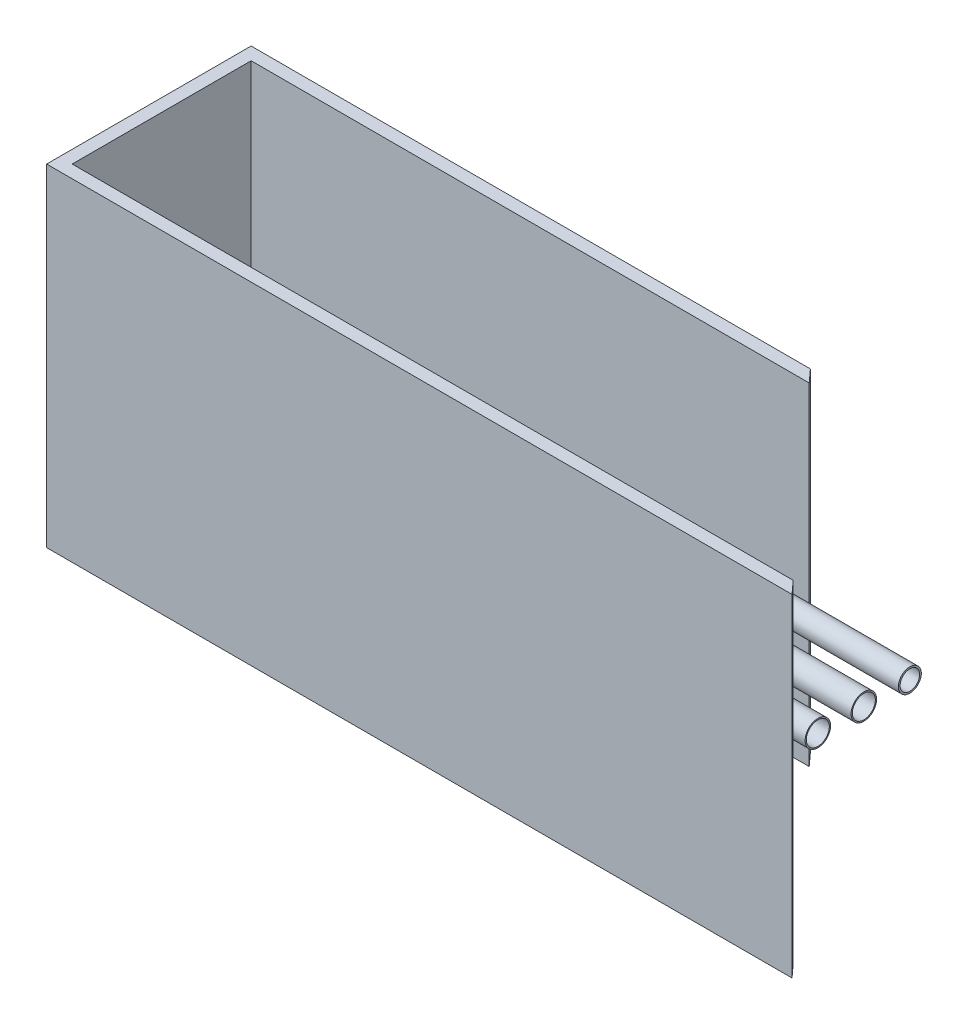
from build123d import *

# Parameters (mm, degrees)
SALIENTE_EXTRUIR1_DEPTH      = 100
SALIENTE_EXTRUIR1_DEPTH_BACK = 1200
CROQUIS1_W                   = 3350
CROQUIS1_H                   = 800
CROQUIS1_W_2                 = 3250
CROQUIS1_H_2                 = 700
CORTAR_EXTRUIR1_DEPTH        = 1448
CROQUIS3_R                   = 44.927583668
CROQUIS3_R_2                 = 38.1
CROQUIS3_R_3                 = 49.927583668


with BuildPart() as part:
    # Croquis1 → Saliente-Extruir1 (new, two sides: drawn at the far end of the back side and taken through both)
    with BuildSketch(Plane(origin=(0, 0, 0), x_dir=(1, 0, 0), z_dir=(0, 1, 0)).offset(-SALIENTE_EXTRUIR1_DEPTH_BACK)):
        Rectangle(CROQUIS1_W, CROQUIS1_H)
        Rectangle(CROQUIS1_W_2, CROQUIS1_H_2, mode=Mode.SUBTRACT)
    extrude(amount=SALIENTE_EXTRUIR1_DEPTH + SALIENTE_EXTRUIR1_DEPTH_BACK)

    # Croquis2 → Cortar-Extruir1 (cut)
    with BuildSketch(Plane(origin=(0, 100, 0), x_dir=(1, 0, 0), z_dir=(0, 1, 0))):
        Polygon((1241.59041613, -400), (513.347548089, 400), (1675, 400), (1675, -400), align=None)
    extrude(amount=-CORTAR_EXTRUIR1_DEPTH, mode=Mode.SUBTRACT)

    # Barrer1: sweep along a curve in space
    with BuildLine() as barrer1_path:
        Line((-1675, -550, 169.682408269), (1112.341688093, -550, 169.682408269))
    # Croquis3 → Barrer1 (sweep)
    # profile 1 of 3: a face of its own
    with BuildSketch(Plane.ZY.offset(1675)):
        with Locations((-190.317591731, -550)):
            Circle(CROQUIS3_R)
        with Locations((-190.317591731, -550)):
            Circle(CROQUIS3_R_2, mode=Mode.SUBTRACT)
    # profile 2 of 3: a face of its own
    with BuildSketch(Plane.ZY.offset(1675)):
        with Locations((-10.317591731, -550)):
            Circle(CROQUIS3_R_3)
        with Locations((-10.317591731, -550)):
            Circle(CROQUIS3_R, mode=Mode.SUBTRACT)
    # profile 3 of 3: a face of its own
    with BuildSketch(Plane.ZY.offset(1675)):
        with Locations((169.682408269, -550)):
            Circle(CROQUIS3_R_3)
        with Locations((169.682408269, -550)):
            Circle(CROQUIS3_R, mode=Mode.SUBTRACT)
    sweep(path=barrer1_path.line)


solid = part.part
